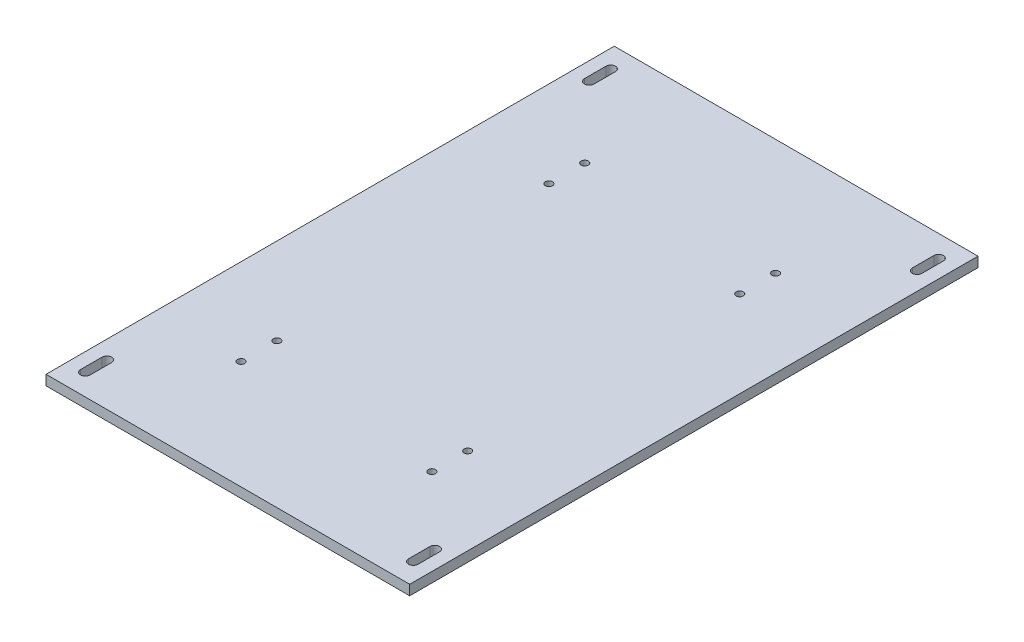
from build123d import *

# Parameters (mm, degrees)
SKETCH1_W                                = 203.2
SKETCH1_H                                = 317.5
BOSS_EXTRUDE1_DEPTH                      = 5.588
SKETCH3_R                                = 2
SKETCH3_R_2                              = 2.000000004
CUT_EXTRUDE2_DEPTH                       = 468.664781924
SKETCH6_R                                = 2.65
CUT_EXTRUDE4_DEPTH                       = 468.664781924
CUT_EXTRUDE5_DEPTH                       = 189.561258598
MIRROR3_AT_THE_SECOND_PLANE_COPY_1_DEPTH = 189.561258598


with BuildPart() as part:
    # Sketch1 → Boss-Extrude1 (new body)
    with BuildSketch(Plane(origin=(0, 0, 0), x_dir=(1, 0, 0), z_dir=(0, 1, 0))):
        Rectangle(SKETCH1_W, SKETCH1_H)
    extrude(amount=BOSS_EXTRUDE1_DEPTH)

    # Sketch3 → Cut-Extrude2 (cut, through all)
    with BuildSketch(Plane(origin=(-338.26084164, 0, 0), x_dir=(1, 0, 0), z_dir=(0, -1, 0))):
        with Locations(Location((391.56084164, -93.936114691, 0), (0, 0, 270))):
            Circle(SKETCH3_R)
        with Locations(Location((391.56084164, -73.936114691, 0), (0, 0, 270))):
            Circle(SKETCH3_R)
        with Locations(Location((391.56084164, 78.063885309, 0), (0, 0, 270))):
            Circle(SKETCH3_R_2)
        with Locations(Location((391.56084164, 98.063885309, 0), (0, 0, 270))):
            Circle(SKETCH3_R)
    cut_extrude2 = extrude(amount=-CUT_EXTRUDE2_DEPTH, mode=Mode.SUBTRACT)

    # Mirror2: Cut-Extrude2 across plane
    add(cut_extrude2.mirror(Plane(origin=(0, 0, 0), x_dir=(0, 0, 1), z_dir=(1, 0, 0))), mode=Mode.SUBTRACT)

    # Sketch6 → Cut-Extrude4 (cut, through all)
    with BuildSketch(Plane(origin=(-338.26084164, 5.588, 0), x_dir=(1, 0, 0), z_dir=(0, 1, 0))):
        with Locations(Location((429.86084164, 136.812, 0), (0, 0, 270))):
            Circle(SKETCH6_R)
    extrude(amount=-CUT_EXTRUDE4_DEPTH, mode=Mode.SUBTRACT)

    # Sketch7 → Cut-Extrude5 (cut, through all)
    with BuildSketch(Plane.XZ):
        with BuildLine():
            Line((88.95, -146.75), (88.95, -134.75))
            ThreePointArc((88.95, -134.75), (91.6, -132.1), (94.25, -134.75))
            Line((94.25, -134.75), (94.25, -146.75))
            ThreePointArc((94.25, -146.75), (91.6, -149.4), (88.95, -146.75))
        make_face()
    cut_extrude5 = extrude(amount=-CUT_EXTRUDE5_DEPTH, mode=Mode.SUBTRACT)

    # Mirror3: Cut-Extrude5 across plane
    add(cut_extrude5.mirror(Plane(origin=(0, 0, 0), x_dir=(0, 0, 1), z_dir=(1, 0, 0))), mode=Mode.SUBTRACT)

    # Mirror3 at the second plane: Cut-Extrude5 across plane
    add(cut_extrude5.mirror(Plane.XY), mode=Mode.SUBTRACT)

    # Mirror3 at the second plane copy 1 sketc → Mirror3 at the second plane copy 1 (cut, through all)
    with BuildSketch(Plane(origin=(0, 0, 0), x_dir=(-1, 0, 0), z_dir=(0, -1, 0))):
        with BuildLine():
            Line((88.95, -146.75), (88.95, -134.75))
            ThreePointArc((88.95, -134.75), (91.6, -132.1), (94.25, -134.75))
            Line((94.25, -134.75), (94.25, -146.75))
            ThreePointArc((94.25, -146.75), (91.6, -149.4), (88.95, -146.75))
        make_face()
    extrude(amount=-MIRROR3_AT_THE_SECOND_PLANE_COPY_1_DEPTH, mode=Mode.SUBTRACT)


solid = part.part
